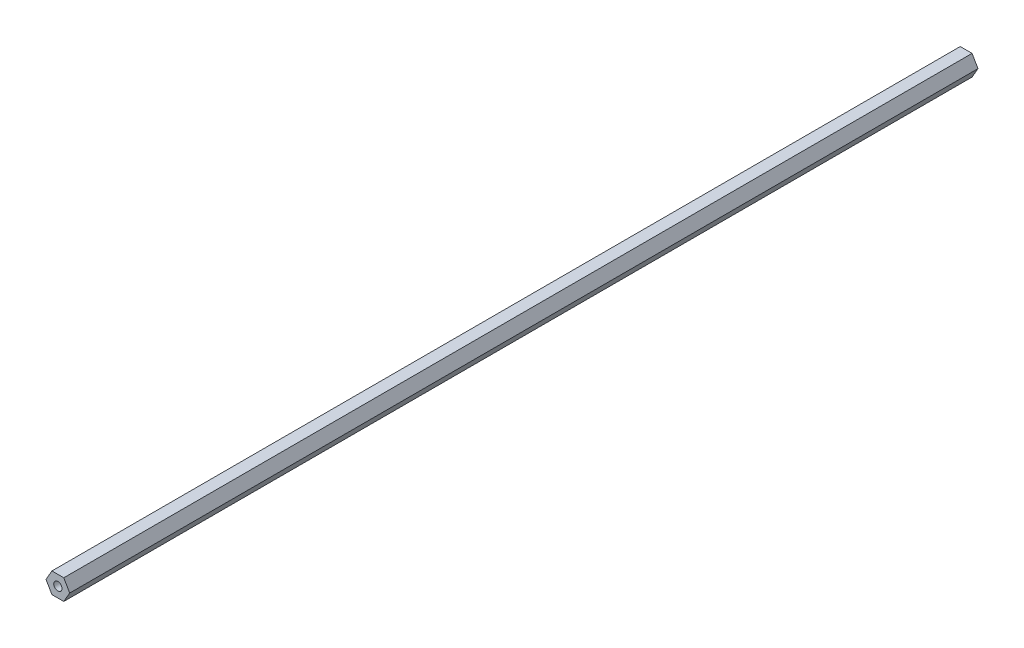
from build123d import *

# Parameters (mm, degrees)
BOSS_EXTRUDE1_DEPTH         = 561.975
F_1_4_20_TAPPED_HOLE1_D     = 5.1054
F_1_4_20_TAPPED_HOLE1_DEPTH = 16.51
F_1_4_20_TAPPED_HOLE1_TIP   = 1.533816902
F_1_4_20_TAPPED_HOLE2_D     = 5.1054
F_1_4_20_TAPPED_HOLE2_DEPTH = 16.51
F_1_4_20_TAPPED_HOLE2_TIP   = 1.533816902


with BuildPart() as part:
    # Sketch1 → Boss-Extrude1 (new body)
    with BuildSketch(Plane.XY):
        Polygon((7.332348419, 0), (3.666174209, 6.35), (-3.666174209, 6.35), (-7.332348419, 0), (-3.666174209, -6.35), (3.666174209, -6.35), align=None)
    extrude(amount=BOSS_EXTRUDE1_DEPTH)

    # 1/4-20 Tapped Hole1
    with Locations(Plane.XY.offset(561.975)):
        with Locations((0, 0)):
            Hole(F_1_4_20_TAPPED_HOLE1_D / 2, depth=F_1_4_20_TAPPED_HOLE1_DEPTH)
            with Locations((0, 0, -(F_1_4_20_TAPPED_HOLE1_DEPTH + F_1_4_20_TAPPED_HOLE1_TIP / 2))):  # 118° drill point
                Cone(0, F_1_4_20_TAPPED_HOLE1_D / 2, F_1_4_20_TAPPED_HOLE1_TIP, mode=Mode.SUBTRACT)

    # 1/4-20 Tapped Hole2
    with Locations(Plane(origin=(0, 0, 0), x_dir=(-1, 0, 0), z_dir=(0, 0, -1))):
        with Locations((0, 0)):
            Hole(F_1_4_20_TAPPED_HOLE2_D / 2, depth=F_1_4_20_TAPPED_HOLE2_DEPTH)
            with Locations((0, 0, -(F_1_4_20_TAPPED_HOLE2_DEPTH + F_1_4_20_TAPPED_HOLE2_TIP / 2))):  # 118° drill point
                Cone(0, F_1_4_20_TAPPED_HOLE2_D / 2, F_1_4_20_TAPPED_HOLE2_TIP, mode=Mode.SUBTRACT)


solid = part.part
